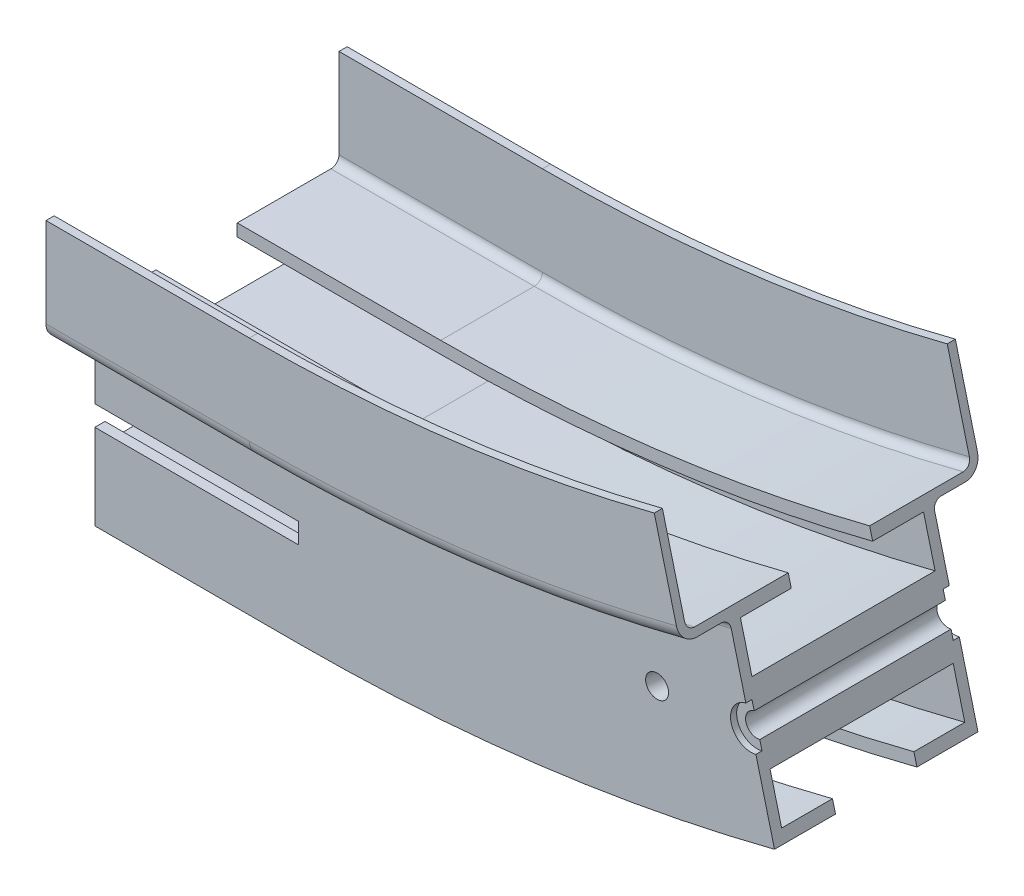
from build123d import *

# Parameters (mm, degrees)
ESTRUSIONE_ESTRUSIONE1_DEPTH = 50
SMUSSO1_SIZE                 = 1.6
RIVOLUZIONE1_ANGLE           = 14.31
FORO_PER_VITE_M5_2_D         = 5.6
FORO_PER_VITE_M5_2_DEPTH     = 120
FORO_PER_VITE_M5_2_TIP       = 1.682409733


with BuildPart() as part:
    # Schizzo1 → Estrusione-Estrusione1 (new body)
    with BuildSketch(Plane(origin=(0, 0, 0), x_dir=(0, 0, -1), z_dir=(1, 0, 0))):
        with BuildLine():
            Line((-10, -23.5), (-10, -20.5))
            Line((-10, -20.5), (-22.5, -20.5))
            Line((-22.5, -20.5), (-22.5, -9))
            Line((-22.5, -9), (22.5, -9))
            Line((22.5, -9), (22.5, -20.5))
            Line((22.5, -20.5), (10, -20.5))
            Line((10, -20.5), (10, -23.5))
            Line((10, -23.5), (25, -23.5))
            Line((25, -23.5), (25, -2.5))
            Line((25, -2.5), (22.5, -2.5))
            Line((22.5, -2.5), (22.5, -7))
            Line((22.5, -7), (12.5, -7))
            Line((12.5, -7), (12.5, 7))
            Line((12.5, 7), (22.5, 7))
            Line((22.5, 7), (22.5, 2.5))
            Line((22.5, 2.5), (25, 2.5))
            Line((25, 2.5), (25, 19.5))
            ThreePointArc((25, 19.5), (25.585786438, 20.914213562), (27, 21.5))
            Line((27, 21.5), (33, 21.5))
            ThreePointArc((33, 21.5), (35.828427125, 22.671572875), (37, 25.5))
            Line((37, 25.5), (37, 47.5))
            Line((37, 47.5), (35, 47.5))
            Line((35, 47.5), (35, 25.5))
            ThreePointArc((35, 25.5), (34.414213562, 24.085786438), (33, 23.5))
            Line((33, 23.5), (10, 23.5))
            Line((10, 23.5), (10, 20.5))
            Line((10, 20.5), (22.5, 20.5))
            Line((22.5, 20.5), (22.5, 9))
            Line((22.5, 9), (-22.5, 9))
            Line((-22.5, 9), (-22.5, 20.5))
            Line((-22.5, 20.5), (-10, 20.5))
            Line((-10, 20.5), (-10, 23.5))
            Line((-10, 23.5), (-33, 23.5))
            ThreePointArc((-33, 23.5), (-34.414213562, 24.085786438), (-35, 25.5))
            Line((-35, 25.5), (-35, 47.5))
            Line((-35, 47.5), (-37, 47.5))
            Line((-37, 47.5), (-37, 25.5))
            ThreePointArc((-37, 25.5), (-35.828427125, 22.671572875), (-33, 21.5))
            Line((-33, 21.5), (-27, 21.5))
            ThreePointArc((-27, 21.5), (-25.585786438, 20.914213562), (-25, 19.5))
            Line((-25, 19.5), (-25, 2.5))
            Line((-25, 2.5), (-22.5, 2.5))
            Line((-22.5, 2.5), (-22.5, 7))
            Line((-22.5, 7), (-12.5, 7))
            Line((-12.5, 7), (-12.5, -7))
            Line((-12.5, -7), (-22.5, -7))
            Line((-22.5, -7), (-22.5, -2.5))
            Line((-22.5, -2.5), (-25, -2.5))
            Line((-25, -2.5), (-25, -23.5))
            Line((-25, -23.5), (-10, -23.5))
        make_face()
        with BuildLine():
            Line((-8.5, 7), (8.5, 7))
            ThreePointArc((8.5, 7), (9.560660172, 6.560660172), (10, 5.5))
            Line((10, 5.5), (10, -5.5))
            ThreePointArc((10, -5.5), (9.560660172, -6.560660172), (8.5, -7))
            Line((8.5, -7), (-8.5, -7))
            ThreePointArc((-8.5, -7), (-9.560660172, -6.560660172), (-10, -5.5))
            Line((-10, -5.5), (-10, 5.5))
            ThreePointArc((-10, 5.5), (-9.560660172, 6.560660172), (-8.5, 7))
        make_face(mode=Mode.SUBTRACT)
    extrude(amount=ESTRUSIONE_ESTRUSIONE1_DEPTH)

    # Smusso1
    smusso1_edges = [part.edges().sort_by_distance(p)[0] for p in [
        (25, -7, 22.5),
        (25, -7, 12.5),
        (25, 7, 12.5),
        (25, 7, 22.5),
        (25, 7, -22.5),
        (25, 7, -12.5),
        (25, -7, -12.5),
        (25, -7, -22.5),
    ]]
    chamfer(smusso1_edges, length=SMUSSO1_SIZE)

    # Schizzo2 → Rivoluzione1 (revolve)
    with BuildSketch(Plane(origin=(50, 0, 0), x_dir=(0, 0, -1), z_dir=(1, 0, 0))):
        with BuildLine():
            Line((-10, -23.5), (-25, -23.5))
            Line((-25, -23.5), (-25, 19.5))
            ThreePointArc((-25, 19.5), (-25.585786438, 20.914213562), (-27, 21.5))
            Line((-27, 21.5), (-33, 21.5))
            ThreePointArc((-33, 21.5), (-35.828427125, 22.671572875), (-37, 25.5))
            Line((-37, 25.5), (-37, 47.5))
            Line((-37, 47.5), (-35, 47.5))
            Line((-35, 47.5), (-35, 25.5))
            ThreePointArc((-35, 25.5), (-34.414213562, 24.085786438), (-33, 23.5))
            Line((-33, 23.5), (-10, 23.5))
            Line((-10, 23.5), (-10, 20.5))
            Line((-10, 20.5), (-22.5, 20.5))
            Line((-22.5, 20.5), (-22.5, 9))
            Line((-22.5, 9), (22.5, 9))
            Line((22.5, 9), (22.5, 20.5))
            Line((22.5, 20.5), (10, 20.5))
            Line((10, 20.5), (10, 23.5))
            Line((10, 23.5), (33, 23.5))
            ThreePointArc((33, 23.5), (34.414213562, 24.085786438), (35, 25.5))
            Line((35, 25.5), (35, 47.5))
            Line((35, 47.5), (37, 47.5))
            Line((37, 47.5), (37, 25.5))
            ThreePointArc((37, 25.5), (35.828427125, 22.671572875), (33, 21.5))
            Line((33, 21.5), (27, 21.5))
            ThreePointArc((27, 21.5), (25.585786438, 20.914213562), (25, 19.5))
            Line((25, 19.5), (25, -23.5))
            Line((25, -23.5), (10, -23.5))
            Line((10, -23.5), (10, -20.5))
            Line((10, -20.5), (22.5, -20.5))
            Line((22.5, -20.5), (22.5, -9))
            Line((22.5, -9), (-22.5, -9))
            Line((-22.5, -9), (-22.5, -20.5))
            Line((-22.5, -20.5), (-10, -20.5))
            Line((-10, -20.5), (-10, -23.5))
        make_face()
    revolve(axis=Axis((50, 450, 89.886149412), (0, 0, 1)), revolution_arc=RIVOLUZIONE1_ANGLE)

    # Schizzo18 → Taglia-Rivoluzione1 (revolve, cut)
    with BuildSketch(Plane(origin=(154.720013769, 39.4663965, 0), x_dir=(0, 0, -1), z_dir=(0.9689726071879229, 0.24716813411004152, 0))):
        Polygon((-25, -26.320733471), (25, -26.320733471), (25, -21.320733471), (23.5, -21.320733471), (23.5, -23.520733471), (-23.5, -23.520733471), (-23.5, -21.320733471), (-25, -21.320733471), align=None)
    revolve(axis=Axis((161.22566035, 13.962326765, 25), (0, 0, -1)), mode=Mode.SUBTRACT)

    # Foro per Vite M5-2
    with Locations(Plane(origin=(-8.832087888, 0, 67.086367898), x_dir=(0.9914448613738102, 0, 0.13052619222005385), z_dir=(-0.13052619222005385, 0, 0.9914448613738102))):
        with Locations((140.267423642, 11.500002666)):
            Hole(FORO_PER_VITE_M5_2_D / 2, depth=FORO_PER_VITE_M5_2_DEPTH)
            with Locations((0, 0, -(FORO_PER_VITE_M5_2_DEPTH + FORO_PER_VITE_M5_2_TIP / 2))):  # 118° drill point
                Cone(0, FORO_PER_VITE_M5_2_D / 2, FORO_PER_VITE_M5_2_TIP, mode=Mode.SUBTRACT)


solid = part.part
